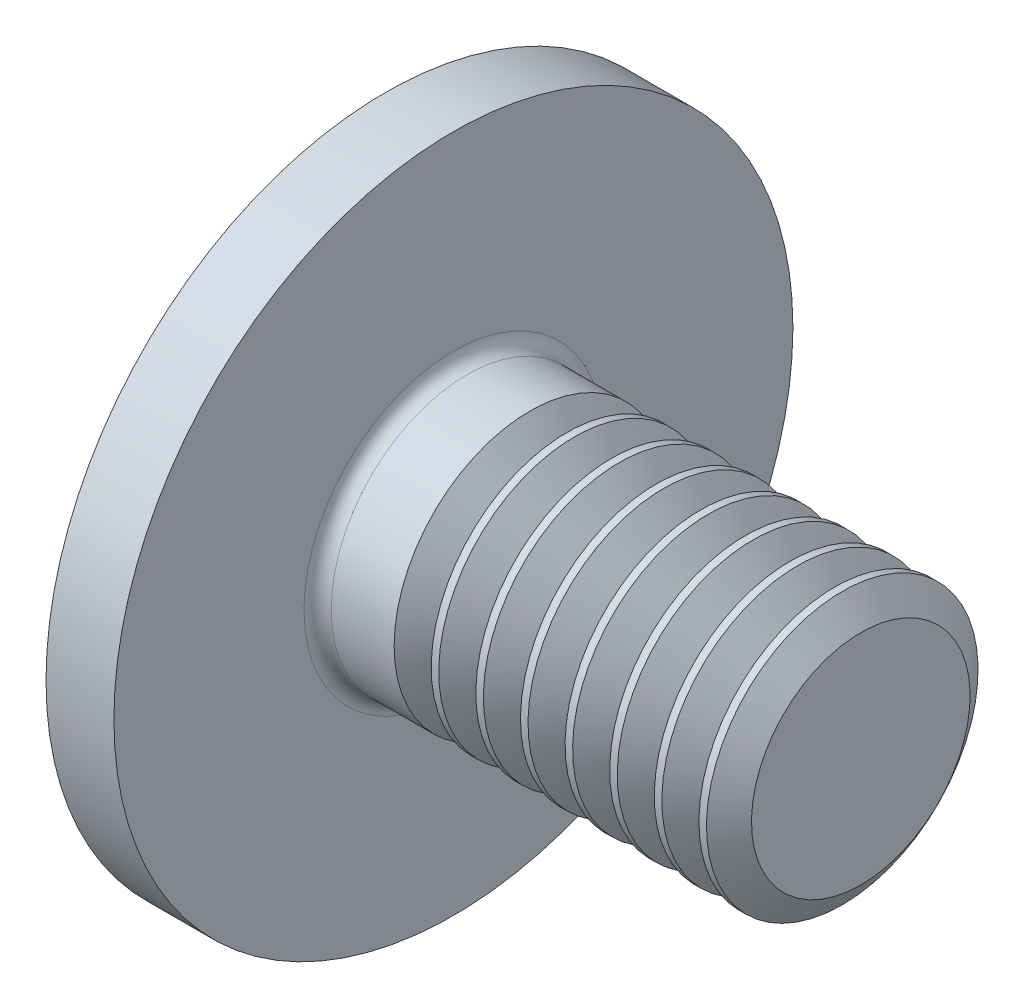
from build123d import *

# Parameters (mm, degrees)
FILLET1_R       = 0.2
RECPAT_COUNT    = 2
RECPAT_ANGLE    = 90
THDSCHPAT_COUNT = 8
THDSCHPAT_PITCH = 0.657142857


with BuildPart() as part:
    # BodySke → Base-Revolve (revolve)
    with BuildSketch(Plane.XY, mode=Mode.PRIVATE) as base_revolve_sk:
        Polygon((3.05, 2), (3.05, 5), (2.05, 5), (2.05, 0), (9.05, 0), (9.05, 2), align=None)
    revolve(base_revolve_sk.sketch.rotate(Axis((-6.35, 0, 0), (1, 0, 0)), 90), axis=Axis((-6.35, 0, 0), (1, 0, 0)))

    # Fillet1
    fillet1_edges = [part.edges().sort_by_distance(p)[0] for p in [
        (3.05, 0, -2),
    ]]
    fillet(fillet1_edges, radius=FILLET1_R)

    # PanSke → Pan (revolve)
    with BuildSketch(Plane.XY):
        with BuildLine():
            Line((2.05, 4.424646879), (2.05, 0))
            Line((2.05, 0), (0, 0))
            ThreePointArc((0, 0), (0.537396082, 2.438237068), (2.05, 4.424646879))
        make_face()
    revolve(axis=Axis((0, 0, 0), (1, 0, 0)))

    # Sketch3 → Recess section 0
    with BuildSketch(Plane(origin=(0, 0, 0), x_dir=(0, 0, -1), z_dir=(1, 0, 0))):
        with BuildLine():
            Line((-0.515, 2.15), (0.515, 2.15))
            Line((0.515, 2.15), (0.515, -2.15))
            Line((0.515, -2.15), (-0.515, -2.15))
            Line((-0.515, -2.15), (-0.515, 2.15))
        make_face()
    # Sketch4 → Recess section 1
    with BuildSketch(Plane(origin=(2.34, 0, 0), x_dir=(0, 0, -1), z_dir=(1, 0, 0))):
        with BuildLine():
            Line((-0.515, 2.106524682), (0.515, 2.106524682))
            Line((0.515, 2.106524682), (0.515, -2.106524682))
            Line((0.515, -2.106524682), (-0.515, -2.106524682))
            Line((-0.515, -2.106524682), (-0.515, 2.106524682))
        make_face()
    recess = loft(mode=Mode.SUBTRACT)

    # RecPat: Recess ×2 about axis
    recpat_axis = Axis((0, 0, 0), (1, 0, 0))
    for i in range(1, RECPAT_COUNT):
        add(recess.rotate(recpat_axis, i * RECPAT_ANGLE / (RECPAT_COUNT - 1)), mode=Mode.SUBTRACT)

    # RecCorSke → RecessCore (revolve, cut)
    with BuildSketch(Plane.XY, mode=Mode.PRIVATE) as recesscore_sk:
        Polygon((0, 0), (0, 1.172663335), (4.6, 0.851), (4.876506661, 0), align=None)
    revolve(recesscore_sk.sketch.rotate(Axis((-3.175, 0, 0), (1, 0, 0)), 90), axis=Axis((-3.175, 0, 0), (1, 0, 0)), mode=Mode.SUBTRACT)

    # ThdSchSke → ThreadSchematic (revolve, cut)
    with BuildSketch(Plane.XY, mode=Mode.PRIVATE) as threadschematic_sk:
        Polygon((4.45, -1.61), (4.17691906, -2), (4.17691906, -2.5), (4.72308094, -2.5), (4.72308094, -2), align=None)
    threadschematic = revolve(threadschematic_sk.sketch.rotate(Axis((-3.175, 0, 0), (1, 0, 0)), 270), axis=Axis((-3.175, 0, 0), (1, 0, 0)), mode=Mode.SUBTRACT)

    # ThdSchPat: ThreadSchematic ×8
    with Locations(*[(i * THDSCHPAT_PITCH, 0, 0) for i in range(1, THDSCHPAT_COUNT)]):
        add(threadschematic, mode=Mode.SUBTRACT)


solid = part.part
